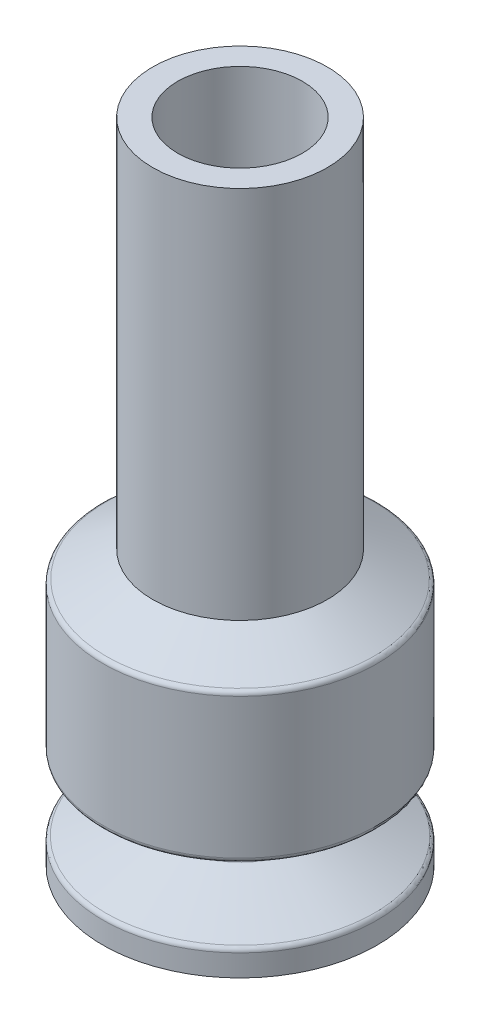
from build123d import *

# Parameters (mm, degrees)
BOSS_EXTRUDE1_START = 15
SKETCH2_R           = 3.5
SKETCH2_R_2         = 2.5
BOSS_EXTRUDE1_DEPTH = 15


with BuildPart() as part:
    # Sketch1 → Revolve5 (revolve)
    with BuildSketch(Plane.XY, mode=Mode.PRIVATE) as revolve5_sk:
        with BuildLine():
            Line((5.5, 9.776976075), (5.5, 4.159943031))
            ThreePointArc((5.5, 4.159943031), (5.473205885, 4.059944424), (5.400002786, 3.986739559))
            Line((5.400002786, 3.986739559), (2.842676107, 2.510211469))
            ThreePointArc((2.842676107, 2.510211469), (2.742988192, 2.325889372), (2.862522305, 2.153773389))
            Line((2.862522305, 2.153773389), (5.380156588, 1.052425899))
            ThreePointArc((5.380156588, 1.052425899), (5.467378788, 0.978664307), (5.5, 0.869191292))
            Line((5.5, 0.869191292), (5.5, 0))
            Line((5.5, 0), (5, 0))
            Line((5, 0), (5, 0.542169521))
            ThreePointArc((5, 0.542169521), (4.967378788, 0.651642536), (4.880156588, 0.725404128))
            Line((4.880156588, 0.725404128), (1.937086224, 2.012860047))
            ThreePointArc((1.937086224, 2.012860047), (1.757785055, 2.271034021), (1.907316928, 2.547517166))
            Line((1.907316928, 2.547517166), (4.900002786, 4.275409332))
            ThreePointArc((4.900002786, 4.275409332), (4.973205885, 4.348614197), (5, 4.448612804))
            Line((5, 4.448612804), (5, 9.425846177))
            ThreePointArc((5, 9.425846177), (4.963672433, 9.540786747), (4.867886654, 9.613972204))
            Line((4.867886654, 9.613972204), (3.5, 10.468441441))
            Line((3.5, 10.468441441), (2.5, 10.468441441))
            Line((2.5, 10.468441441), (2.5, 11))
            Line((2.5, 11), (3.5, 11))
            Line((3.5, 11), (5.367886654, 9.965102103))
            ThreePointArc((5.367886654, 9.965102103), (5.463672433, 9.891916645), (5.5, 9.776976075))
        make_face()
    revolve(revolve5_sk.sketch.rotate(Axis((0, 0, 0), (0, 1, 0)), 90), axis=Axis((0, 0, 0), (0, 1, 0)))

    # Sketch2 → Boss-Extrude1 (add)
    with BuildSketch(Plane(origin=(0, 11, 0), x_dir=(1, 0, 0), z_dir=(0, 1, 0)).offset(BOSS_EXTRUDE1_START)):
        with Locations(Location((0, 0, 0), (0, 0, 270))):
            Circle(SKETCH2_R)
        with Locations(Location((0, 0, 0), (0, 0, 90))):
            Circle(SKETCH2_R_2, mode=Mode.SUBTRACT)
    extrude(amount=-BOSS_EXTRUDE1_DEPTH)


solid = part.part
